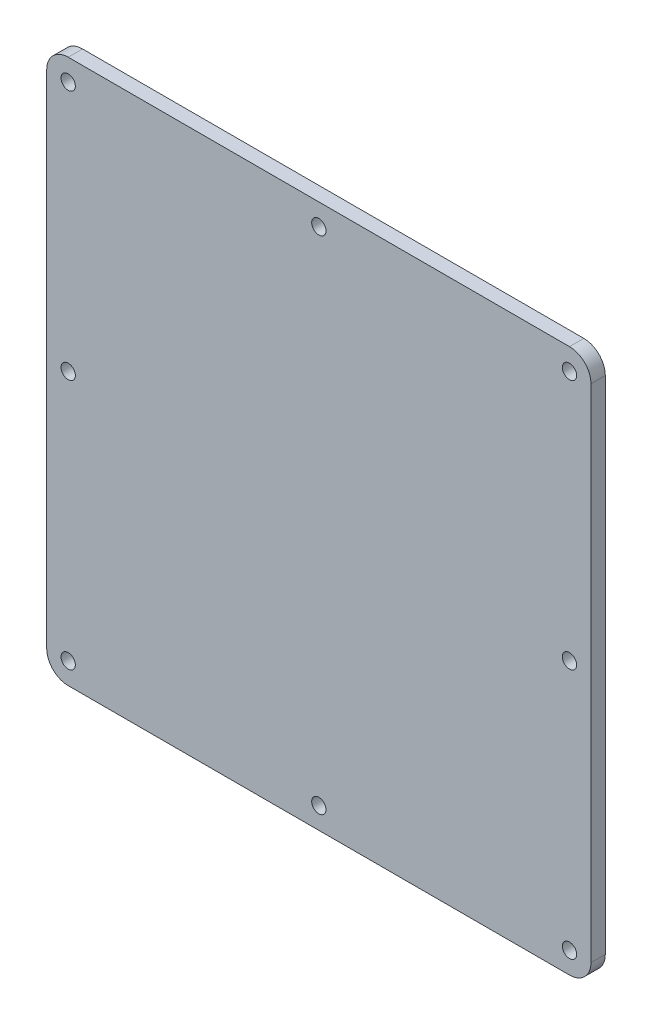
from build123d import *

# Parameters (mm, degrees)
SKETCH2_R           = 5
BOSS_EXTRUDE1_DEPTH = 10


with BuildPart() as part:
    # Sketch2 → Boss-Extrude1 (new body)
    with BuildSketch(Plane.XY):
        with BuildLine():
            Line((-175, 190), (175, 190))
            ThreePointArc((175, 190), (185.606601718, 185.606601718), (190, 175))
            Line((190, 175), (190, -175))
            ThreePointArc((190, -175), (185.606601718, -185.606601718), (175, -190))
            Line((175, -190), (-175, -190))
            ThreePointArc((-175, -190), (-185.606601718, -185.606601718), (-190, -175))
            Line((-190, -175), (-190, 175))
            ThreePointArc((-190, 175), (-185.606601718, 185.606601718), (-175, 190))
        make_face()
        with Locations((-175, 175)):
            Circle(SKETCH2_R, mode=Mode.SUBTRACT)
        with Locations((0, 175)):
            Circle(SKETCH2_R, mode=Mode.SUBTRACT)
        with Locations((175, 175)):
            Circle(SKETCH2_R, mode=Mode.SUBTRACT)
        with Locations((175, 0)):
            Circle(SKETCH2_R, mode=Mode.SUBTRACT)
        with Locations((-175, 0)):
            Circle(SKETCH2_R, mode=Mode.SUBTRACT)
        with Locations((-175, -175)):
            Circle(SKETCH2_R, mode=Mode.SUBTRACT)
        with Locations((0, -175)):
            Circle(SKETCH2_R, mode=Mode.SUBTRACT)
        with Locations((175, -175)):
            Circle(SKETCH2_R, mode=Mode.SUBTRACT)
    extrude(amount=BOSS_EXTRUDE1_DEPTH)


solid = part.part
